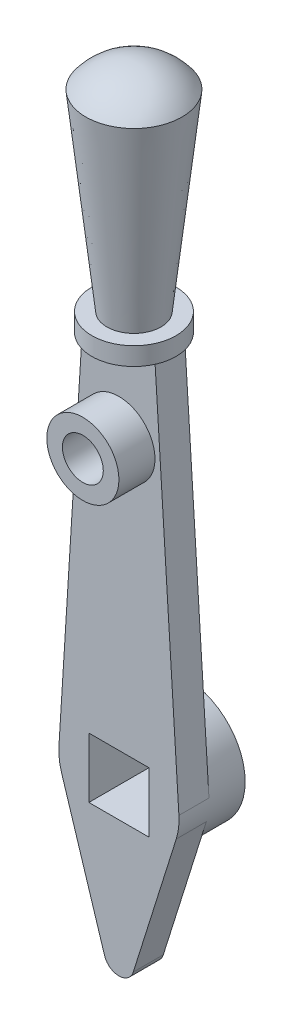
from build123d import *

# Parameters (mm, degrees)
BOSS_EXTRUDE1_DEPTH = 2.5
SKETCH3_R           = 10
BOSS_EXTRUDE2_DEPTH = 11
SKETCH4_R           = 6
BOSS_EXTRUDE3_DEPTH = 6
M8_TAPPED_HOLE1_D   = 6.8
SKETCH7_W           = 10
SKETCH7_H           = 10
CUT_EXTRUDE1_DEPTH  = 67.970142601


with BuildPart() as part:
    # Sketch2 → Boss-Extrude1 (new, symmetric)
    with BuildSketch(Plane.XY):
        with BuildLine():
            Line((-9.539392014, -3), (-2.384848004, -25.75))
            ThreePointArc((-2.384848004, -25.75), (0, -27.5), (2.384848004, -25.75))
            Line((2.384848004, -25.75), (9.539392014, -3))
            ThreePointArc((9.539392014, -3), (9.92690409, -1.206886566), (9.980334012, 0.626843686))
            Line((9.980334012, 0.626843686), (6, 64))
            Line((6, 64), (-6, 64))
            Line((-6, 64), (-9.980334012, 0.626843686))
            ThreePointArc((-9.980334012, 0.626843686), (-9.92690409, -1.206886566), (-9.539392014, -3))
        make_face()
    extrude(amount=BOSS_EXTRUDE1_DEPTH, both=True)

    # Sketch3 → Boss-Extrude2 (add)
    with BuildSketch(Plane.XY.offset(2.5)):
        with Locations(Location((0, 0, 0), (0, 0, 176.406094003))):
            Circle(SKETCH3_R)
    extrude(amount=-BOSS_EXTRUDE2_DEPTH)

    # Sketch4 → Boss-Extrude3 (add)
    with BuildSketch(Plane.XY.offset(2.5)):
        with Locations((0, 50)):
            Circle(SKETCH4_R)
    extrude(amount=BOSS_EXTRUDE3_DEPTH)

    # M8 Tapped Hole1 (through all)
    with Locations(Plane.XY.offset(8.5)):
        with Locations((0, 50)):
            Hole(M8_TAPPED_HOLE1_D / 2)

    # Sketch7 → Cut-Extrude1 (cut, through all)
    with BuildSketch(Plane(origin=(0, 0, -8.5), x_dir=(-1, 0, 0), z_dir=(0, 0, -1))):
        Rectangle(SKETCH7_W, SKETCH7_H)
    extrude(amount=-CUT_EXTRUDE1_DEPTH, mode=Mode.SUBTRACT)

    # Sketch8 → Revolve1 (revolve)
    with BuildSketch(Plane.XY, mode=Mode.PRIVATE) as revolve1_sk:
        with BuildLine():
            Line((0, 64), (-7, 64))
            Line((-7, 64), (-7, 67))
            Line((-7, 67), (-4.5, 67))
            Line((-4.5, 67), (-8, 99))
            ThreePointArc((-8, 99), (-4.472135955, 101.94427191), (0, 103))
            Line((0, 103), (0, 64))
        make_face()
    revolve(revolve1_sk.sketch.rotate(Axis((0, 0, 0), (0, 1, 0)), 270), axis=Axis((0, 0, 0), (0, 1, 0)))


solid = part.part
